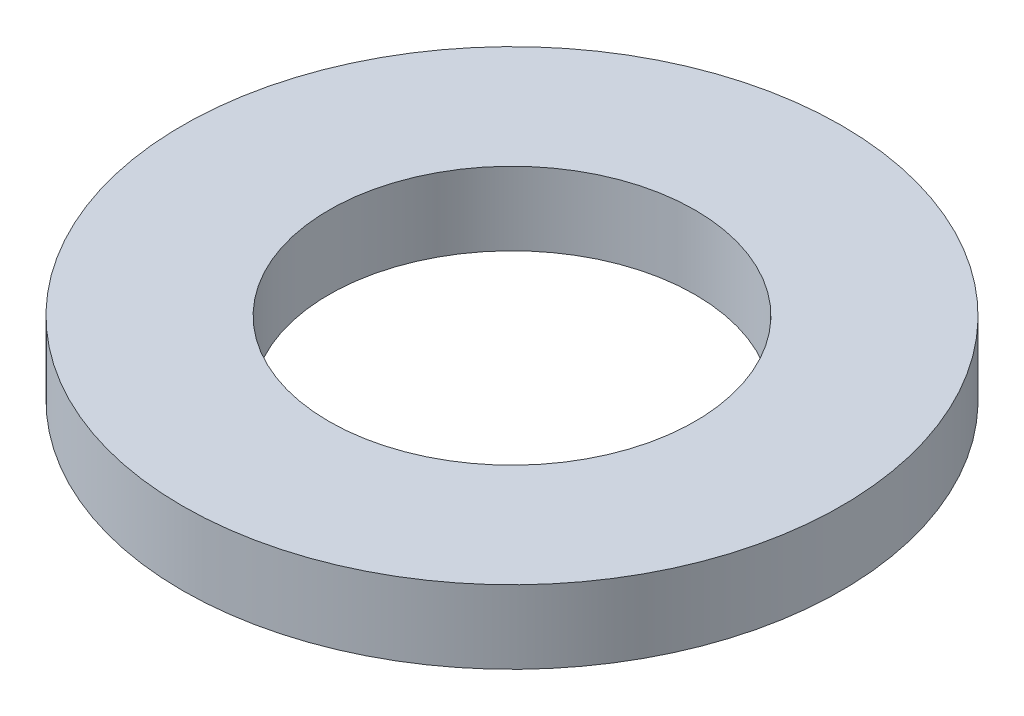
from build123d import *

# Parameters (mm, degrees)
SKETCH_1_R      = 4.5
SKETCH_1_R_2    = 2.5
EXTRUDE_1_DEPTH = 1


with BuildPart() as part:
    # 草图1 → 凸台-拉伸1 (new body)
    with BuildSketch(Plane(origin=(0, 0, 0), x_dir=(1, 0, 0), z_dir=(0, 1, 0))):
        with Locations(Location((0, 0, 0), (0, 0, 270))):
            Circle(SKETCH_1_R)
        with Locations(Location((0, 0, 0), (0, 0, 270))):
            Circle(SKETCH_1_R_2, mode=Mode.SUBTRACT)
    extrude(amount=EXTRUDE_1_DEPTH)


solid = part.part
